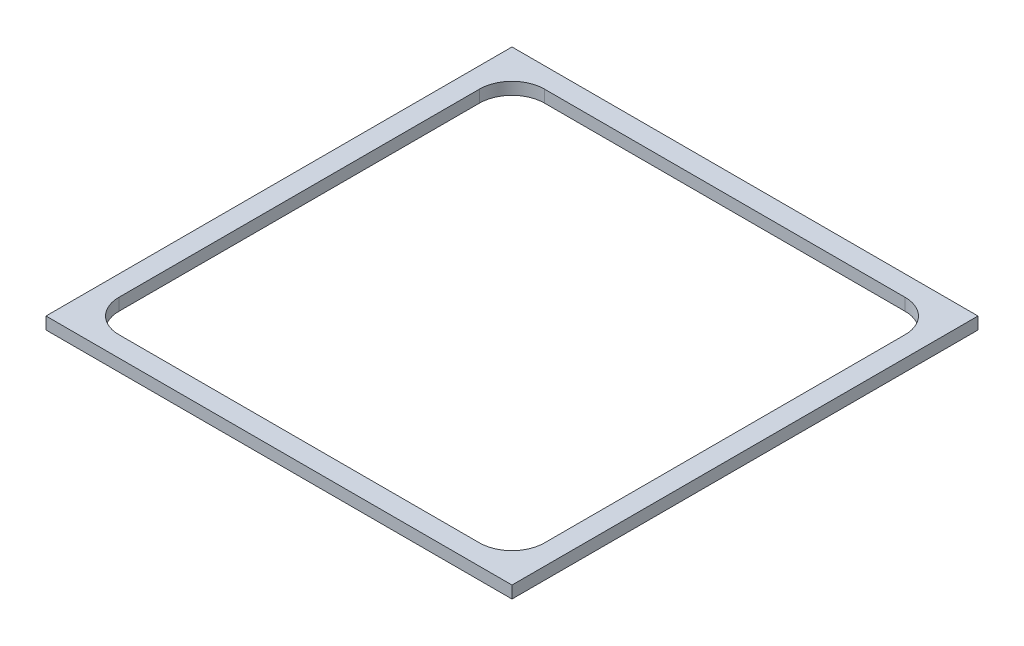
from build123d import *

# Parameters (mm, degrees)
SKETCH_1_W      = 115
SKETCH_1_H      = 115
EXTRUDE_1_DEPTH = 3


with BuildPart() as part:
    # Эскиз1 → Бобышка-Вытянуть1 (new body)
    with BuildSketch(Plane(origin=(0, 0, 0), x_dir=(1, 0, 0), z_dir=(0, 1, 0))):
        Rectangle(SKETCH_1_W, SKETCH_1_H)
        with BuildLine():
            Line((-44.5, -52.5), (44.5, -52.5))
            ThreePointArc((44.5, -52.5), (50.156854249, -50.156854249), (52.5, -44.5))
            Line((52.5, -44.5), (52.5, 44.5))
            ThreePointArc((52.5, 44.5), (50.156854249, 50.156854249), (44.5, 52.5))
            Line((44.5, 52.5), (-44.5, 52.5))
            ThreePointArc((-44.5, 52.5), (-50.156854249, 50.156854249), (-52.5, 44.5))
            Line((-52.5, 44.5), (-52.5, -44.5))
            ThreePointArc((-52.5, -44.5), (-50.156854249, -50.156854249), (-44.5, -52.5))
        make_face(mode=Mode.SUBTRACT)
    extrude(amount=EXTRUDE_1_DEPTH)


solid = part.part
